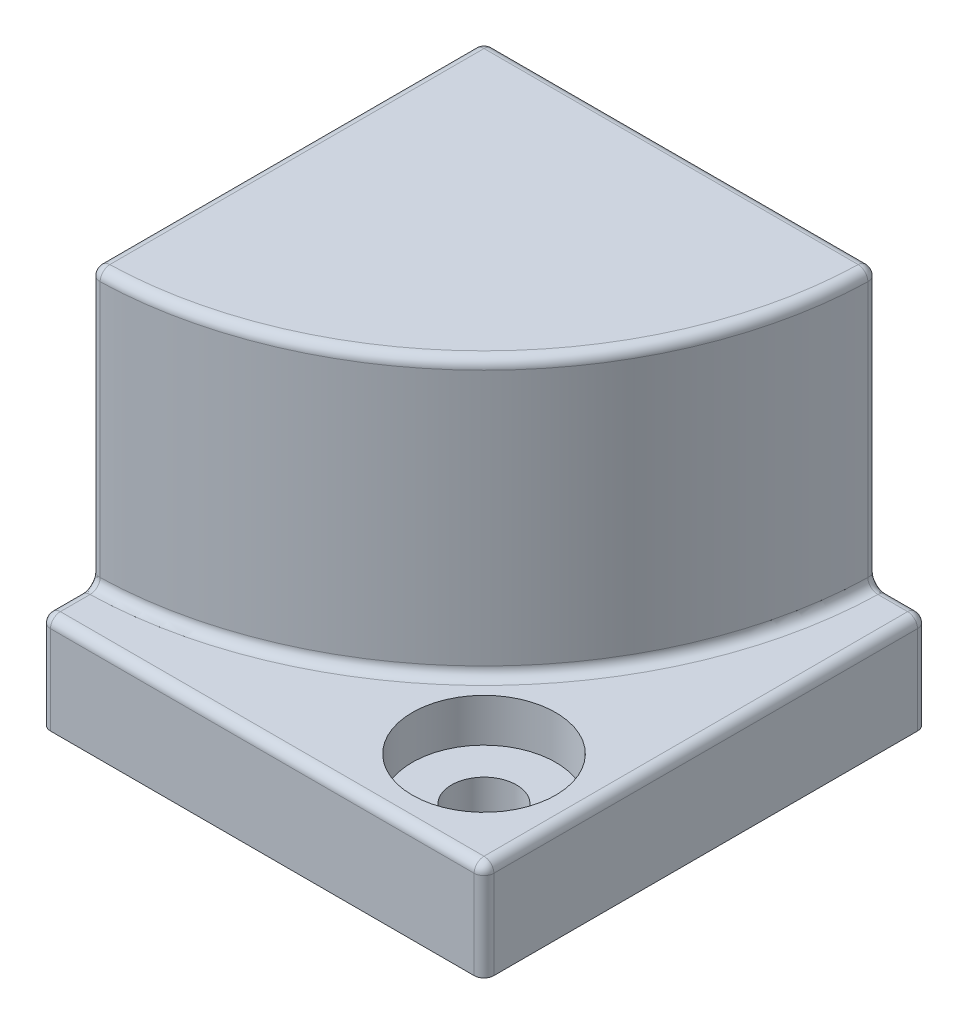
from build123d import *

# Parameters (mm, degrees)
SKETCH3_W                               = 45
SKETCH3_H                               = 45
BOSS_EXTRUDE1_DEPTH                     = 10
CBORE_FOR_M6_HEX_HEAD_BOLT1_D           = 6.6
CBORE_FOR_M6_HEX_HEAD_BOLT1_CBORE_D     = 14.55
CBORE_FOR_M6_HEX_HEAD_BOLT1_CBORE_DEPTH = 4.38
BOSS_EXTRUDE3_DEPTH                     = 18
BOSS_EXTRUDE4_DEPTH                     = 10
SKETCH10_R                              = 3
CUT_EXTRUDE2_DEPTH                      = 6
FILLET2_R                               = 1


with BuildPart() as part:
    # Sketch3 → Boss-Extrude1 (new body)
    with BuildSketch(Plane(origin=(0, 0, 0), x_dir=(1, 0, 0), z_dir=(0, 1, 0))):
        Rectangle(SKETCH3_W, SKETCH3_H)
    extrude(amount=BOSS_EXTRUDE1_DEPTH)

    # CBORE for M6 Hex Head Bolt1 (through all)
    with Locations(Plane(origin=(0, 10, 0), x_dir=(1, 0, 0), z_dir=(0, 1, 0))):
        with Locations((12.5, -12.5)):
            CounterBoreHole(CBORE_FOR_M6_HEX_HEAD_BOLT1_D / 2, CBORE_FOR_M6_HEX_HEAD_BOLT1_CBORE_D / 2, CBORE_FOR_M6_HEX_HEAD_BOLT1_CBORE_DEPTH)

    # Sketch8 → Boss-Extrude3 (add)
    with BuildSketch(Plane(origin=(0, 10, 0), x_dir=(1, 0, 0), z_dir=(0, 1, 0))):
        with BuildLine():
            Line((17.5, 22.5), (7.5, 22.5))
            ThreePointArc((7.5, 22.5), (-1.286796564, 1.286796564), (-22.5, -7.5))
            Line((-22.5, -7.5), (-22.5, -17.5))
            ThreePointArc((-22.5, -17.5), (5.784271247, -5.784271247), (17.5, 22.5))
        make_face()
    extrude(amount=BOSS_EXTRUDE3_DEPTH)

    # Sketch9 → Boss-Extrude4 (add)
    with BuildSketch(Plane(origin=(0, 28, 0), x_dir=(1, 0, 0), z_dir=(0, 1, 0))):
        with BuildLine():
            Line((17.5, 22.5), (-22.5, 22.5))
            Line((-22.5, 22.5), (-22.5, -17.5))
            ThreePointArc((-22.5, -17.5), (5.784271247, -5.784271247), (17.5, 22.5))
        make_face()
    extrude(amount=BOSS_EXTRUDE4_DEPTH)

    # Sketch10 → Cut-Extrude2 (cut)
    with BuildSketch(Plane(origin=(0, 10, 0), x_dir=(1, 0, 0), z_dir=(0, 1, 0))):
        with Locations(Location((-10, 10, 0), (0, 0, 270))):
            Circle(SKETCH10_R)
    extrude(amount=-CUT_EXTRUDE2_DEPTH, mode=Mode.SUBTRACT)

    # Fillet2
    fillet2_edges = [part.edges().sort_by_distance(p)[0] for p in [
        (-22.5, 10, -7.5),
        (0, 10, 22.5),
        (-7.5, 10, -22.5),
        (-22.5, 10, 20),
        (5.784271247, 10, 5.784271247),
        (-22.5, 24, 17.5),
        (17.5, 24, -22.5),
        (-1.286796564, 10, -1.286796564),
        (7.5, 19, -22.5),
        (-22.5, 19, 7.5),
        (-1.286796564, 28, -1.286796564),
        (-22.5, 28, -7.5),
        (-22.5, 33, -22.5),
        (-7.5, 28, -22.5),
        (-22.5, 38, -2.5),
        (5.784271247, 38, 5.784271247),
        (-2.5, 38, -22.5),
        (22.5, 10, 0),
        (22.5, 5, 22.5),
        (-22.5, 5, 22.5),
        (-22.5, 5, -22.5),
        (22.5, 5, -22.5),
        (20, 10, -22.5),
    ]]
    fillet(fillet2_edges, radius=FILLET2_R)


solid = part.part
